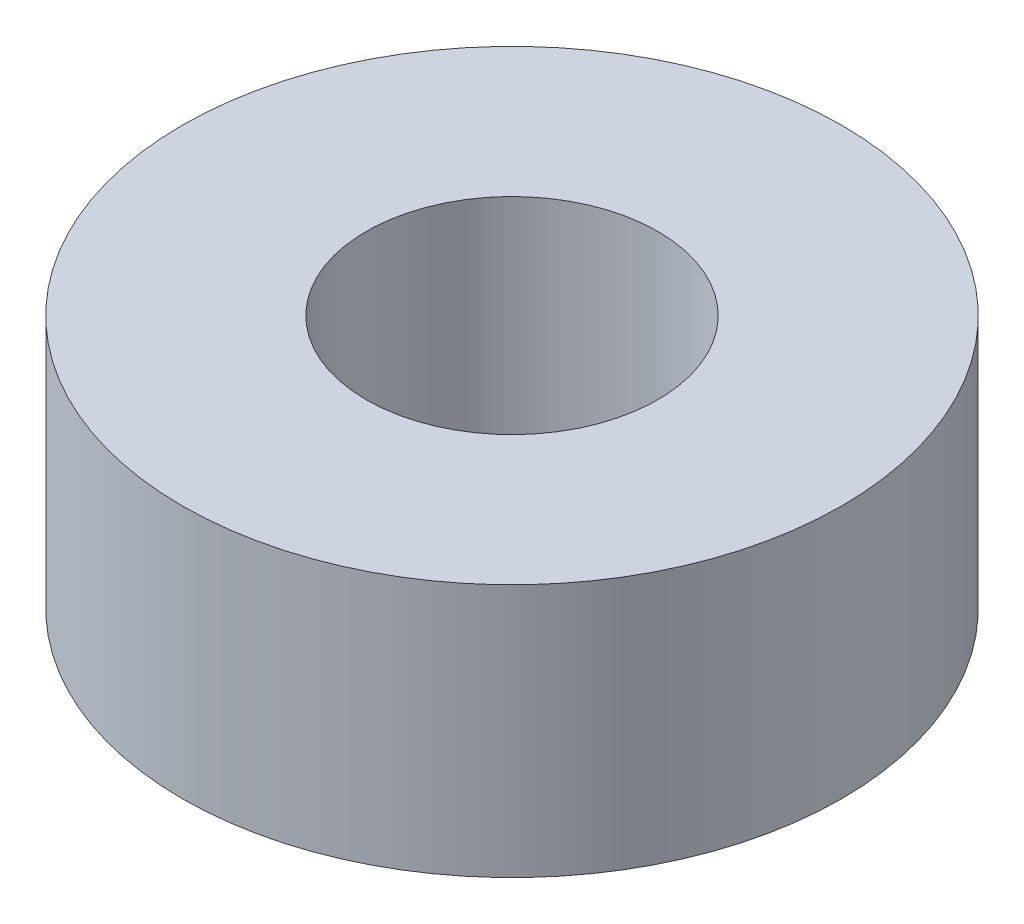
from build123d import *

# Parameters (mm, degrees)
SKETCH1_R           = 26
SKETCH1_R_2         = 11.5
BOSS_EXTRUDE1_DEPTH = 10


with BuildPart() as part:
    # Sketch1 → Boss-Extrude1 (new, symmetric)
    with BuildSketch(Plane(origin=(0, 0, 0), x_dir=(1, 0, 0), z_dir=(0, 1, 0))):
        with Locations(Location((0, 0, 0), (0, 0, 270))):
            Circle(SKETCH1_R)
        with Locations(Location((0, 0, 0), (0, 0, 270))):
            Circle(SKETCH1_R_2, mode=Mode.SUBTRACT)
    extrude(amount=BOSS_EXTRUDE1_DEPTH, both=True)


solid = part.part
